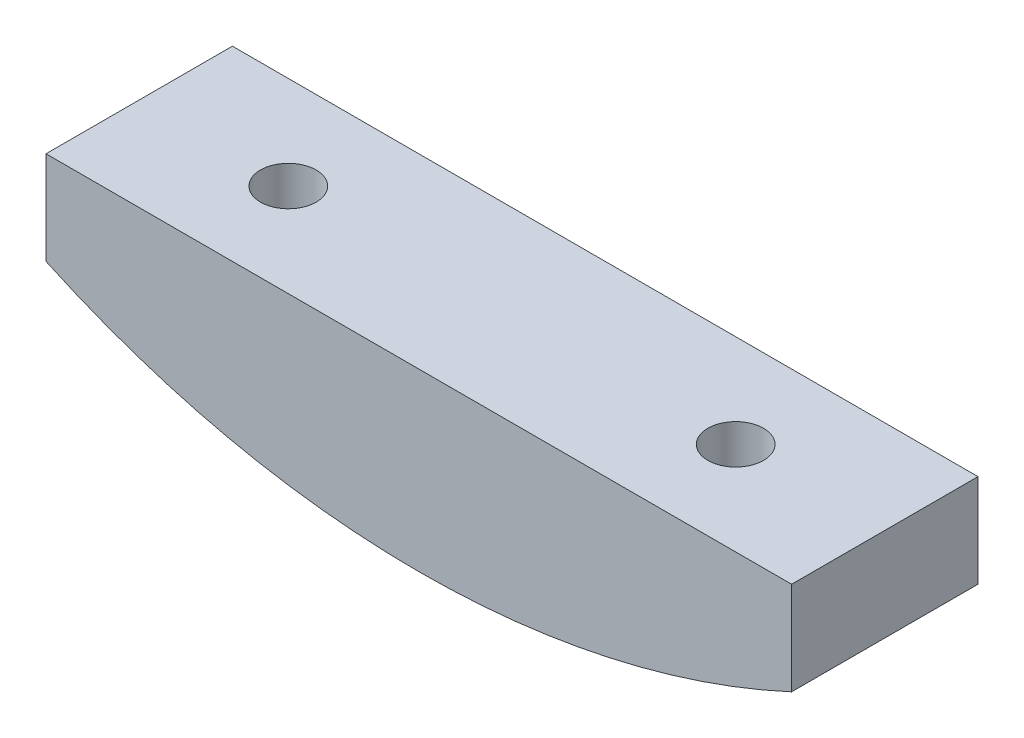
from build123d import *
from build123d.topology import SkipClean

# Parameters (mm, degrees)
SKETCH1_W              = 50.8
SKETCH1_H              = 44.45
BOSS_EXTRUDE1_DEPTH    = 6.35
BOSS_EXTRUDE2_DEPTH    = 44.45
M4X0_7_TAPPED_HOLE1_D  = 3.3
BOSS_EXTRUDE3_DEPTH    = 12.7
F_10_24_TAPPED_HOLE1_D = 3.7973
SKETCH10_W             = 50.8
SKETCH10_H             = 44.45
CUT_EXTRUDE1_DEPTH     = 25.4


with BuildPart() as part:
    # Sketch1 → Boss-Extrude1 (new body)
    with BuildSketch(Plane(origin=(0, 0, 0), x_dir=(1, 0, 0), z_dir=(0, 1, 0))):
        Rectangle(SKETCH1_W, SKETCH1_H)
    extrude(amount=BOSS_EXTRUDE1_DEPTH)

    # Sketch2 → Boss-Extrude2 (add)
    with BuildSketch(Plane.XY.offset(22.225)):
        with BuildLine():
            Line((-25.4, 0), (25.4, 0))
            ThreePointArc((25.4, 0), (0, -5.608040792), (-25.4, 0))
        make_face()
    extrude(amount=-BOSS_EXTRUDE2_DEPTH)

    # M4x0.7 Tapped Hole1 (through all)
    with Locations(Plane(origin=(0, 6.35, 0), x_dir=(1, 0, 0), z_dir=(0, 1, 0))):
        with Locations((0, 14.6499912), (-17.9500022, -14.6500088), (17.9499978, -14.6500088)):
            Hole(M4X0_7_TAPPED_HOLE1_D / 2)

    # Sketch6 → Boss-Extrude3 (add)
    with SkipClean():  # the faces are left unmerged after this step: merging them gives an invalid solid
        with BuildSketch(Plane(origin=(0, 0, -22.225), x_dir=(-1, 0, 0), z_dir=(0, 0, -1))):
            with BuildLine():
                Line((-25.4, 6.35), (25.4, 6.35))
                Line((25.4, 6.35), (25.4, 0))
                ThreePointArc((25.4, 0), (0, -5.608040792), (-25.4, 0))
                Line((-25.4, 0), (-25.4, 6.35))
            make_face()
        extrude(amount=BOSS_EXTRUDE3_DEPTH)

    # #10-24 Tapped Hole1 (through all)
    with Locations(Plane(origin=(0, 6.35, 0), x_dir=(1, 0, 0), z_dir=(0, 1, 0))):
        with Locations((-15.24, 28.575), (15.24, 28.575)):
            Hole(F_10_24_TAPPED_HOLE1_D / 2)

    # Sketch10 → Cut-Extrude1 (cut)
    with BuildSketch(Plane(origin=(0, 6.35, 0), x_dir=(1, 0, 0), z_dir=(0, 1, 0))):
        Rectangle(SKETCH10_W, SKETCH10_H)
    extrude(amount=-CUT_EXTRUDE1_DEPTH, mode=Mode.SUBTRACT)


solid = part.part
